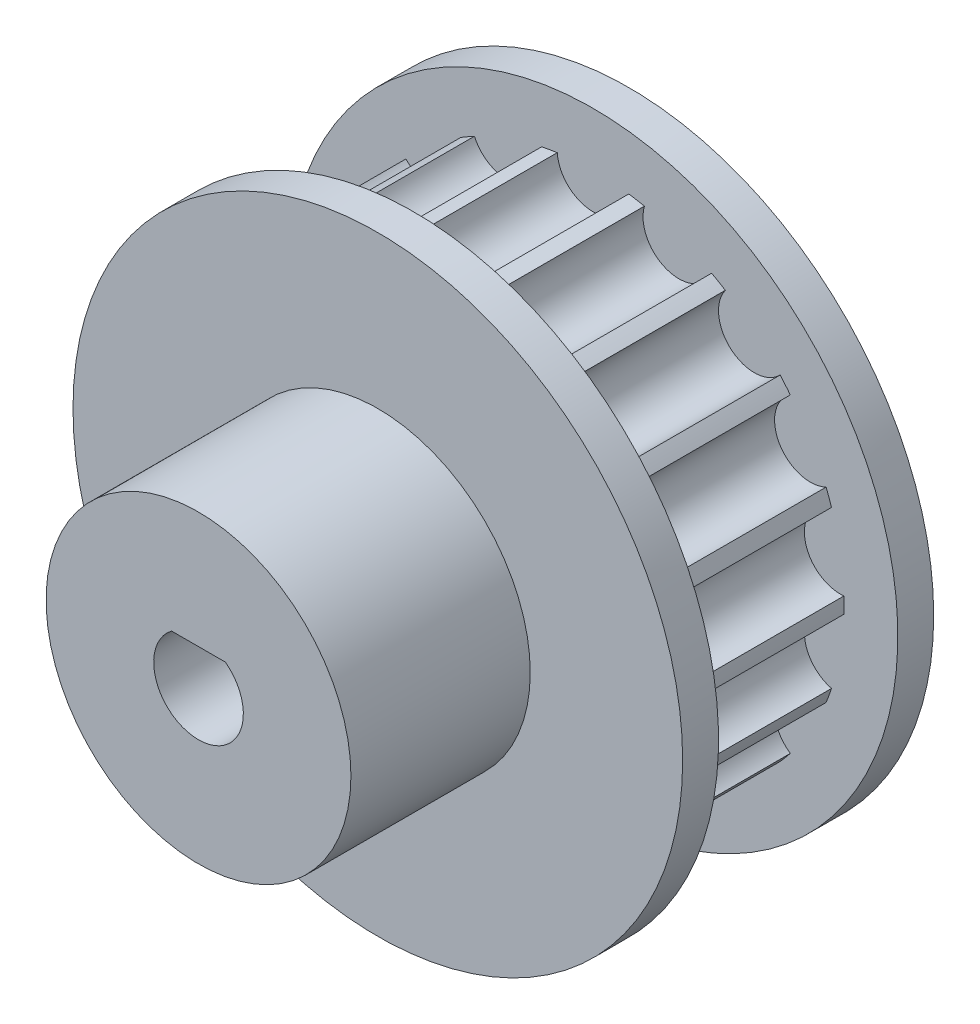
from build123d import *

# Parameters (mm, degrees)
SKETCH1_R           = 17
BOSS_EXTRUDE1_DEPTH = 14
CUT_EXTRUDE2_REACH  = 29.821
SKETCH3_R           = 2.5
BOSS_EXTRUDE2_START = 10
SKETCH5_R           = 8.5
SKETCH5_R_2         = 2.5
BOSS_EXTRUDE2_DEPTH = 10
BOSS_EXTRUDE3_DEPTH = 24
SKETCH7_R           = 17
SKETCH7_R_2         = 14
CUT_EXTRUDE5_DEPTH  = 5
SKETCH8_R           = 2
CUT_EXTRUDE6_DEPTH  = 5


with BuildPart() as part:
    # Sketch1 → Boss-Extrude1 (new body)
    with BuildSketch(Plane.XY):
        Circle(SKETCH1_R)
    extrude(amount=BOSS_EXTRUDE1_DEPTH)

    # Sketch3 → Cut-Extrude2 (cut, up to next)
    with BuildSketch(Plane.XY.offset(14), mode=Mode.PRIVATE) as cut_extrude2_sk1:
        Circle(SKETCH3_R)
    cut_extrude2_tool1 = extrude(cut_extrude2_sk1.sketch, amount=-CUT_EXTRUDE2_REACH, mode=Mode.PRIVATE) & part.part
    add(cut_extrude2_tool1.solids().sort_by_distance((0, 0, 14))[0], mode=Mode.SUBTRACT)

    # Sketch5 → Boss-Extrude2 (add)
    with BuildSketch(Plane.XY.offset(14).offset(BOSS_EXTRUDE2_START)):
        Circle(SKETCH5_R)
        Circle(SKETCH5_R_2, mode=Mode.SUBTRACT)
    extrude(amount=-BOSS_EXTRUDE2_DEPTH)

    # Sketch6 → Boss-Extrude3 (add)
    with BuildSketch(Plane.XY.offset(24)):
        with BuildLine():
            Line((1.5, 2), (-1.5, 2))
            ThreePointArc((-1.5, 2), (0, 2.5), (1.5, 2))
        make_face()
    extrude(amount=-BOSS_EXTRUDE3_DEPTH)

    # Sketch7 → Cut-Extrude5 (cut, symmetric)
    with BuildSketch(Plane(origin=(0, 0, 7), x_dir=(-1, 0, 0), z_dir=(0, 0, -1))):
        Circle(SKETCH7_R)
        Circle(SKETCH7_R_2, mode=Mode.SUBTRACT)
    extrude(amount=CUT_EXTRUDE5_DEPTH, both=True, mode=Mode.SUBTRACT)

    # Sketch8 → Cut-Extrude6 (cut, symmetric)
    with BuildSketch(Plane(origin=(0, 0, 7), x_dir=(-1, 0, 0), z_dir=(0, 0, -1))):
        with Locations((0, 14)):
            Circle(SKETCH8_R)
        with Locations((4.788282007, 13.155696691)):
            Circle(SKETCH8_R)
        with Locations((8.999026536, 10.724622204)):
            Circle(SKETCH8_R)
        with Locations((12.124355653, 7)):
            Circle(SKETCH8_R)
        with Locations((13.787308542, 2.431074487)):
            Circle(SKETCH8_R)
        with Locations((13.787308542, -2.431074487)):
            Circle(SKETCH8_R)
        with Locations((12.124355653, -7)):
            Circle(SKETCH8_R)
        with Locations((8.999026536, -10.724622204)):
            Circle(SKETCH8_R)
        with Locations((4.788282007, -13.155696691)):
            Circle(SKETCH8_R)
        with Locations((0, -14)):
            Circle(SKETCH8_R)
        with Locations((-4.788282007, -13.155696691)):
            Circle(SKETCH8_R)
        with Locations((-8.999026536, -10.724622204)):
            Circle(SKETCH8_R)
        with Locations((-12.124355653, -7)):
            Circle(SKETCH8_R)
        with Locations((-13.787308542, -2.431074487)):
            Circle(SKETCH8_R)
        with Locations((-13.787308542, 2.431074487)):
            Circle(SKETCH8_R)
        with Locations((-12.124355653, 7)):
            Circle(SKETCH8_R)
        with Locations((-8.999026536, 10.724622204)):
            Circle(SKETCH8_R)
        with Locations((-4.788282007, 13.155696691)):
            Circle(SKETCH8_R)
    extrude(amount=CUT_EXTRUDE6_DEPTH, both=True, mode=Mode.SUBTRACT)


solid = part.part
